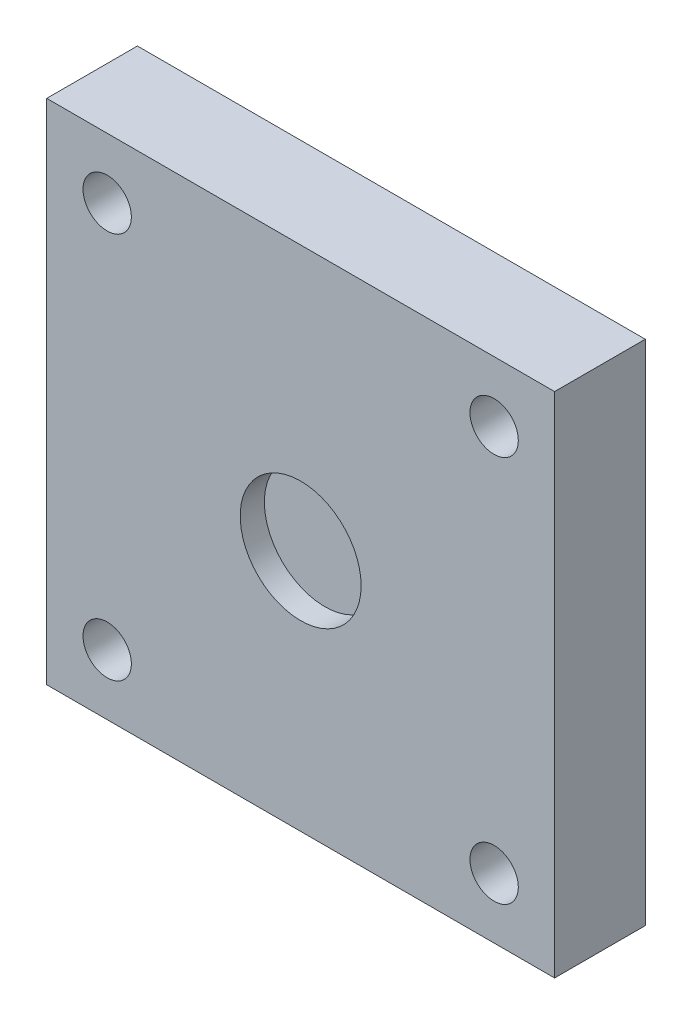
from build123d import *

# Parameters (mm, degrees)
SKETCH2_W           = 42
SKETCH2_H           = 42
SKETCH2_R           = 2
BOSS_EXTRUDE3_DEPTH = 5.5
SKETCH5_W           = 42
SKETCH5_H           = 42
SKETCH5_R           = 2
SKETCH5_R_2         = 5
BOSS_EXTRUDE5_DEPTH = 2


with BuildPart() as part:
    # Sketch2 → Boss-Extrude3 (new body)
    with BuildSketch(Plane.XY):
        with Locations((17.05217694, 12.5)):
            Rectangle(SKETCH2_W, SKETCH2_H)
        with Locations((1.05217694, -3.5)):
            Circle(SKETCH2_R, mode=Mode.SUBTRACT)
        with Locations((33.05217694, -3.5)):
            Circle(SKETCH2_R, mode=Mode.SUBTRACT)
        with Locations((1.05217694, 28.5)):
            Circle(SKETCH2_R, mode=Mode.SUBTRACT)
        with Locations((33.05217694, 28.5)):
            Circle(SKETCH2_R, mode=Mode.SUBTRACT)
    extrude(amount=BOSS_EXTRUDE3_DEPTH)

    # Sketch5 → Boss-Extrude5 (add)
    with BuildSketch(Plane.XY.offset(5.5)):
        with Locations((17.05217694, 12.5)):
            Rectangle(SKETCH5_W, SKETCH5_H)
        with Locations((1.05217694, -3.5)):
            Circle(SKETCH5_R, mode=Mode.SUBTRACT)
        with Locations((17.05217694, 11.592136271)):
            Circle(SKETCH5_R_2, mode=Mode.SUBTRACT)
        with Locations((33.05217694, -3.5)):
            Circle(SKETCH5_R, mode=Mode.SUBTRACT)
        with Locations((1.05217694, 28.5)):
            Circle(SKETCH5_R, mode=Mode.SUBTRACT)
        with Locations((33.05217694, 28.5)):
            Circle(SKETCH5_R, mode=Mode.SUBTRACT)
    extrude(amount=BOSS_EXTRUDE5_DEPTH)


solid = part.part
